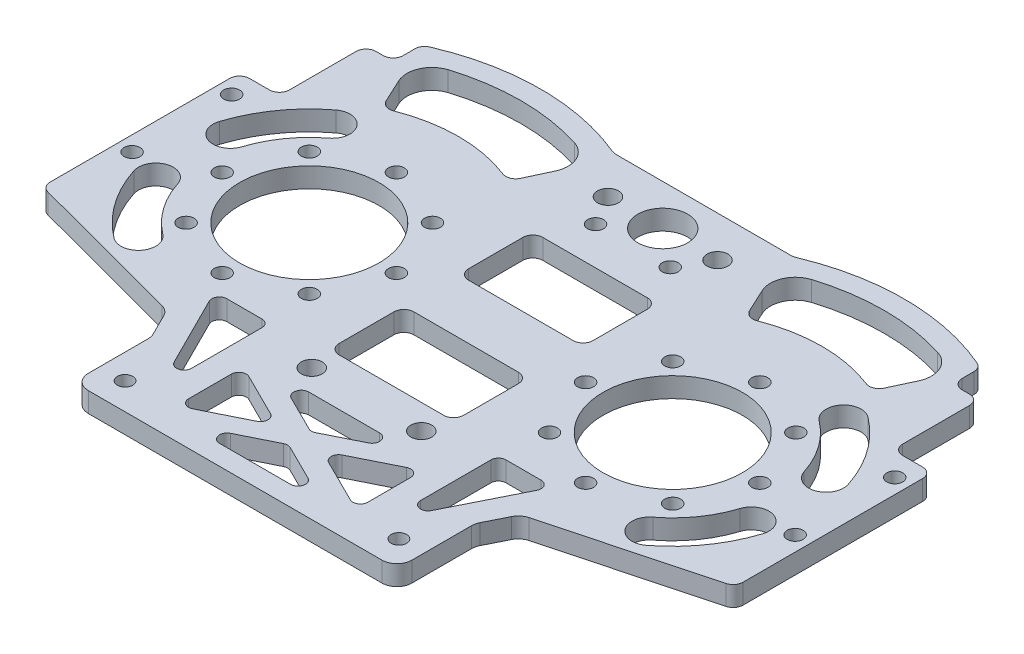
from build123d import *

# Parameters (mm, degrees)
SKETCH_1_W          = 139.2
SKETCH_1_H          = 73
SKETCH_1_R          = 14
EXTRUDE_1_DEPTH     = 4
SKETCH_2_R          = 1.6
CUT_EXTRUDE_1_DEPTH = 4
SKETCH_3_R          = 1.6
SKETCH_3_R_2        = 2.1
CUT_EXTRUDE_2_DEPTH = 79.691867432
EXTRUDE_2_DEPTH     = 4
SKETCH_8_W          = 8
SKETCH_8_H          = 17.4
CUT_EXTRUDE_3_DEPTH = 4
SKETCH_10_W         = 25
SKETCH_10_H         = 14.9
SKETCH_10_H_2       = 15
CUT_EXTRUDE_4_DEPTH = 4
FILLET_2_R          = 5
FILLET_3_R          = 2
SKETCH_11_W         = 36.109827576
SKETCH_11_H         = 6.185229232
EXTRUDE_3_DEPTH     = 4
SKETCH_12_R         = 2.1
CUT_EXTRUDE_5_DEPTH = 4
SKETCH_13_W         = 65
SKETCH_13_H         = 21
SKETCH_13_R         = 1.55
EXTRUDE_4_DEPTH     = 4
SKETCH_14_R         = 5
SKETCH_14_W         = 36
SKETCH_14_H         = 17.893333333
CUT_EXTRUDE_6_DEPTH = 4
EXTRUDE_1_2_DEPTH   = 4
EXTRUDE_5_DEPTH     = 4
FILLET_5_R          = 1.5
FILLET_6_R          = 3
CUT_EXTRUDE_7_DEPTH = 4


with BuildPart() as part:
    # 草图1 → Extrude 1 (new body)
    with BuildSketch(Plane(origin=(0, 0, 0), x_dir=(1, 0, 0), z_dir=(0, 1, 0))):
        Rectangle(SKETCH_1_W, SKETCH_1_H)
        with Locations(Location((-36.5, 0, 0), (0, 0, 270))):
            Circle(SKETCH_1_R, mode=Mode.SUBTRACT)
        with Locations(Location((36.5, 0, 0), (0, 0, 270))):
            Circle(SKETCH_1_R, mode=Mode.SUBTRACT)
    extrude(amount=EXTRUDE_1_DEPTH)

    # 草图2 → 切除-拉伸1 (cut)
    with BuildSketch(Plane(origin=(0, 4, 0), x_dir=(1, 0, 0), z_dir=(0, 1, 0))):
        with Locations(Location((-36.5, 17.5, 0), (0, 0, 270))):
            Circle(SKETCH_2_R)
        with Locations(Location((-24.125631329, 12.374368671, 0), (0, 0, 270))):
            Circle(SKETCH_2_R)
        with Locations(Location((-19, 0, 0), (0, 0, 270))):
            Circle(SKETCH_2_R)
        with Locations(Location((-24.125631329, -12.374368671, 0), (0, 0, 270))):
            Circle(SKETCH_2_R)
        with Locations(Location((-36.5, -17.5, 0), (0, 0, 270))):
            Circle(SKETCH_2_R)
        with Locations(Location((-48.874368671, -12.374368671, 0), (0, 0, 270))):
            Circle(SKETCH_2_R)
        with Locations(Location((-54, 0, 0), (0, 0, 270))):
            Circle(SKETCH_2_R)
        with Locations(Location((-48.874368671, 12.374368671, 0), (0, 0, 270))):
            Circle(SKETCH_2_R)
        with Locations(Location((48.874368671, 12.374368671, 0), (0, 0, 90))):
            Circle(SKETCH_2_R)
        with Locations(Location((54, 0, 0), (0, 0, 90))):
            Circle(SKETCH_2_R)
        with Locations(Location((48.874368671, -12.374368671, 0), (0, 0, 90))):
            Circle(SKETCH_2_R)
        with Locations(Location((36.5, -17.5, 0), (0, 0, 90))):
            Circle(SKETCH_2_R)
        with Locations(Location((24.125631329, -12.374368671, 0), (0, 0, 90))):
            Circle(SKETCH_2_R)
        with Locations(Location((19, 0, 0), (0, 0, 90))):
            Circle(SKETCH_2_R)
        with Locations(Location((24.125631329, 12.374368671, 0), (0, 0, 90))):
            Circle(SKETCH_2_R)
        with Locations(Location((36.5, 17.5, 0), (0, 0, 90))):
            Circle(SKETCH_2_R)
    extrude(amount=-CUT_EXTRUDE_1_DEPTH, mode=Mode.SUBTRACT)

    # 草图3 → 切除-拉伸2 (cut, through all)
    with BuildSketch(Plane(origin=(0, 4, 0), x_dir=(1, 0, 0), z_dir=(0, 1, 0))):
        with Locations(Location((66.6, -5.5, 0), (0, 0, 270))):
            Circle(SKETCH_3_R)
        with Locations(Location((66.6, 14.5, 0), (0, 0, 270))):
            Circle(SKETCH_3_R)
        with Locations(Location((-66.6, 14.5, 0), (0, 0, 90))):
            Circle(SKETCH_3_R)
        with Locations(Location((-66.6, -5.5, 0), (0, 0, 90))):
            Circle(SKETCH_3_R)
        with Locations(Location((11, -25, 0), (0, 0, 270))):
            Circle(SKETCH_3_R_2)
        with Locations(Location((-11, -25, 0), (0, 0, 270))):
            Circle(SKETCH_3_R_2)
        with Locations(Location((7.5, 28.5, 0), (0, 0, 270))):
            Circle(SKETCH_3_R)
        with Locations(Location((-7.5, 28.5, 0), (0, 0, 270))):
            Circle(SKETCH_3_R)
    extrude(amount=-CUT_EXTRUDE_2_DEPTH, mode=Mode.SUBTRACT)

    # 草图7 → 凸台-拉伸2 (add)
    with BuildSketch(Plane(origin=(0, 4, 0), x_dir=(1, 0, 0), z_dir=(0, 1, 0))):
        with BuildLine():
            Line((56.151749171, 36.5), (56.151749171, 42.143312097))
            ThreePointArc((56.151749171, 42.143312097), (36.5, 46.5), (16.848250829, 42.143312097))
            Line((16.848250829, 42.143312097), (16.848250829, 36.5))
            Line((16.848250829, 36.5), (56.151749171, 36.5))
        make_face()
        with BuildLine():
            Line((-16.848250829, 36.5), (-16.848250829, 42.143312097))
            ThreePointArc((-16.848250829, 42.143312097), (-36.5, 46.5), (-56.151749171, 42.143312097))
            Line((-56.151749171, 42.143312097), (-56.151749171, 36.5))
            Line((-56.151749171, 36.5), (-16.848250829, 36.5))
        make_face()
    extrude(amount=-EXTRUDE_2_DEPTH)

    # 草图8 → 切除-拉伸3 (cut)
    with BuildSketch(Plane(origin=(0, 4, 0), x_dir=(1, 0, 0), z_dir=(0, 1, 0))):
        with Locations((65.6, 27.8)):
            Rectangle(SKETCH_8_W, SKETCH_8_H)
        with BuildLine():
            Line((23.821452148, 27.189233611), (18.538723876, 38.518080949))
            ThreePointArc((18.538723876, 38.518080949), (36.5, 42.5), (54.461276124, 38.518080949))
            Line((54.461276124, 38.518080949), (49.178547852, 27.189233611))
            ThreePointArc((49.178547852, 27.189233611), (36.5, 30), (23.821452148, 27.189233611))
        make_face()
        with BuildLine():
            Line((-49.178547852, 27.189233611), (-54.461276124, 38.518080949))
            ThreePointArc((-54.461276124, 38.518080949), (-36.5, 42.5), (-18.538723876, 38.518080949))
            Line((-18.538723876, 38.518080949), (-23.821452148, 27.189233611))
            ThreePointArc((-23.821452148, 27.189233611), (-36.5, 30), (-49.178547852, 27.189233611))
        make_face()
        with Locations((-65.6, 27.8)):
            Rectangle(SKETCH_8_W, SKETCH_8_H)
    extrude(amount=-CUT_EXTRUDE_3_DEPTH, mode=Mode.SUBTRACT)

    # 草图10 → 切除-拉伸4 (cut)
    with BuildSketch(Plane(origin=(0, 4, 0), x_dir=(1, 0, 0), z_dir=(0, 1, 0))):
        Polygon((69.6, -20.5), (9.6, -36.5), (69.6, -36.5), align=None)
        with Locations((0, 13.45)):
            Rectangle(SKETCH_10_W, SKETCH_10_H)
        with Locations((0, -12.5)):
            Rectangle(SKETCH_10_W, SKETCH_10_H_2)
        Polygon((-69.6, -36.5), (-69.6, -20.5), (-9.6, -36.5), align=None)
    extrude(amount=-CUT_EXTRUDE_4_DEPTH, mode=Mode.SUBTRACT)

    # 圆角2
    fillet_2_edges = [part.edges().sort_by_distance(p)[0] for p in [
        (18.538723876, 2, -38.518080949),
        (54.461276124, 2, -38.518080949),
        (-54.461276124, 2, -38.518080949),
        (-18.538723876, 2, -38.518080949),
    ]]
    fillet(fillet_2_edges, radius=FILLET_2_R)

    # 圆角3
    fillet_3_edges = [part.edges().sort_by_distance(p)[0] for p in [
        (56.151749171, 2, -42.143312097),
        (56.151749171, 2, -36.5),
        (16.848250829, 2, -36.5),
        (16.848250829, 2, -42.143312097),
        (-56.151749171, 2, -42.143312097),
        (-16.848250829, 2, -42.143312097),
        (-16.848250829, 2, -36.5),
        (-56.151749171, 2, -36.5),
        (61.6, 2, -36.5),
        (69.6, 2, -19.1),
        (61.6, 2, -19.1),
        (49.178547852, 2, -27.189233611),
        (23.821452148, 2, -27.189233611),
        (-23.821452148, 2, -27.189233611),
        (-49.178547852, 2, -27.189233611),
        (-69.6, 2, -19.1),
        (-61.6, 2, -36.5),
        (-61.6, 2, -19.1),
        (-12.5, 2, -6),
        (-12.5, 2, -20.9),
        (12.5, 2, -20.9),
        (12.5, 2, -6),
        (-9.6, 2, 36.5),
        (-69.6, 2, 20.5),
        (69.6, 2, 20.5),
        (9.6, 2, 36.5),
        (-12.5, 2, 20),
        (-12.5, 2, 5),
        (12.5, 2, 5),
        (12.5, 2, 20),
    ]]
    fillet(fillet_3_edges, radius=FILLET_3_R)

    # 草图11 → 凸台-拉伸3 (add)
    with BuildSketch(Plane(origin=(0, 4, 0), x_dir=(1, 0, 0), z_dir=(0, 1, 0))):
        with Locations((0, 39.592614616)):
            Rectangle(SKETCH_11_W, SKETCH_11_H)
    extrude(amount=-EXTRUDE_3_DEPTH)

    # 草图12 → 切除-拉伸5 (cut)
    with BuildSketch(Plane(origin=(0, 4, 0), x_dir=(1, 0, 0), z_dir=(0, 1, 0))):
        with Locations(Location((11, 34.5, 0), (0, 0, 270))):
            Circle(SKETCH_12_R)
        with Locations(Location((-11, 34.5, 0), (0, 0, 270))):
            Circle(SKETCH_12_R)
    extrude(amount=-CUT_EXTRUDE_5_DEPTH, mode=Mode.SUBTRACT)

    # 草图13 → 凸台-拉伸4 (add)
    with BuildSketch(Plane.XZ):
        with Locations((0, 40.893333333)):
            Rectangle(SKETCH_13_W, SKETCH_13_H)
        with Locations(Location((-27.5, 46, 0), (0, 0, 270))):
            Circle(SKETCH_13_R, mode=Mode.SUBTRACT)
        with Locations(Location((27.5, 46, 0), (0, 0, 270))):
            Circle(SKETCH_13_R, mode=Mode.SUBTRACT)
    extrude(amount=-EXTRUDE_4_DEPTH)

    # 草图14 → 切除-拉伸6 (cut)
    with BuildSketch(Plane.XZ):
        with Locations(Location((0, -34.5, 0), (0, 0, 270))):
            Circle(SKETCH_14_R)
        Polygon((-23, 43.5), (-34, 21.5), (-23, 21.5), align=None)
        with Locations((0, 38.446666667)):
            Rectangle(SKETCH_14_W, SKETCH_14_H)
        Polygon((34, 21.5), (23, 21.5), (23, 43.5), align=None)
    extrude(amount=-CUT_EXTRUDE_6_DEPTH, mode=Mode.SUBTRACT)

    # 草图15 → Extrude 1 2 (add)
    with BuildSketch(Plane.XZ):
        Polygon((-18.890179405, 45.602361355), (17.109820595, 27.709028022), (18.890179405, 31.290971978), (-17.109820595, 49.184305311), align=None)
        Polygon((-17.109820595, 27.709028022), (18.890179405, 45.602361355), (17.109820595, 49.184305311), (-18.890179405, 31.290971978), align=None)
    extrude(amount=-EXTRUDE_1_2_DEPTH)

    # 草图16 → 凸台-拉伸5 (add)
    with BuildSketch(Plane.XZ):
        Polygon((-35.550196089, 29.57994771), (-32.5, 35.680339887), (-32.5, 30.393333333), align=None)
        Polygon((32.5, 35.680339887), (32.5, 30.393333333), (35.550196089, 29.57994771), align=None)
    extrude(amount=-EXTRUDE_5_DEPTH)

    # 圆角5
    fillet_5_edges = [part.edges().sort_by_distance(p)[0] for p in [
        (-23, 2, 43.5),
        (-23, 2, 21.5),
        (-34, 2, 21.5),
        (23, 2, 43.5),
        (34, 2, 21.5),
        (23, 2, 21.5),
        (-13.506523768, 2, 29.5),
        (13.506523768, 2, 29.5),
        (18, 2, 45.159909221),
        (18, 2, 31.733424112),
        (13.506523768, 2, 47.393333333),
        (-13.506523768, 2, 47.393333333),
        (-18, 2, 31.733424112),
        (-18, 2, 45.159909221),
        (-4.493476232, 2, 38.446666667),
        (0, 2, 40.680090779),
        (4.493476232, 2, 38.446666667),
        (0, 2, 36.213242555),
    ]]
    fillet(fillet_5_edges, radius=FILLET_5_R)

    # 圆角6
    fillet_6_edges = [part.edges().sort_by_distance(p)[0] for p in [
        (18.054913788, 2, -42.685229232),
        (-18.054913788, 2, -42.685229232),
        (-32.5, 2, 51.393333333),
        (32.5, 2, 51.393333333),
        (-35.550196089, 2, 29.57994771),
        (-32.5, 2, 35.680339887),
        (32.5, 2, 35.680339887),
        (35.550196089, 2, 29.57994771),
    ]]
    fillet(fillet_6_edges, radius=FILLET_6_R)

    # 草图17 → 切除-拉伸7 (cut)
    with BuildSketch(Plane.XZ):
        with BuildLine():
            ThreePointArc((-53.451310828, 22.285714286), (-59.356399602, 16.173589498), (-63.155780091, 8.571428571))
            ThreePointArc((-63.155780091, 8.571428571), (-60.895236151, 4.168027489), (-56.491835068, 6.428571429))
            ThreePointArc((-56.491835068, 6.428571429), (-53.642299701, 12.130192123), (-49.213483121, 16.714285714))
            ThreePointArc((-49.213483121, 16.714285714), (-48.546682688, 21.618913853), (-53.451310828, 22.285714286))
        make_face()
        with BuildLine():
            ThreePointArc((-63.155780091, -8.571428571), (-59.356399602, -16.173589498), (-53.451310828, -22.285714286))
            ThreePointArc((-53.451310828, -22.285714286), (-48.546682688, -21.618913853), (-49.213483121, -16.714285714))
            ThreePointArc((-49.213483121, -16.714285714), (-53.642299701, -12.130192123), (-56.491835068, -6.428571429))
            ThreePointArc((-56.491835068, -6.428571429), (-60.895236151, -4.168027489), (-63.155780091, -8.571428571))
        make_face()
        with BuildLine():
            ThreePointArc((53.451310828, 22.285714286), (59.356399602, 16.173589498), (63.155780091, 8.571428571))
            ThreePointArc((63.155780091, 8.571428571), (60.895236151, 4.168027489), (56.491835068, 6.428571429))
            ThreePointArc((56.491835068, 6.428571429), (53.642299701, 12.130192123), (49.213483121, 16.714285714))
            ThreePointArc((49.213483121, 16.714285714), (48.546682688, 21.618913853), (53.451310828, 22.285714286))
        make_face()
        with BuildLine():
            ThreePointArc((63.155780091, -8.571428571), (59.356399602, -16.173589498), (53.451310828, -22.285714286))
            ThreePointArc((53.451310828, -22.285714286), (48.546682688, -21.618913853), (49.213483121, -16.714285714))
            ThreePointArc((49.213483121, -16.714285714), (53.642299701, -12.130192123), (56.491835068, -6.428571429))
            ThreePointArc((56.491835068, -6.428571429), (60.895236151, -4.168027489), (63.155780091, -8.571428571))
        make_face()
    extrude(amount=-CUT_EXTRUDE_7_DEPTH, mode=Mode.SUBTRACT)


solid = part.part
